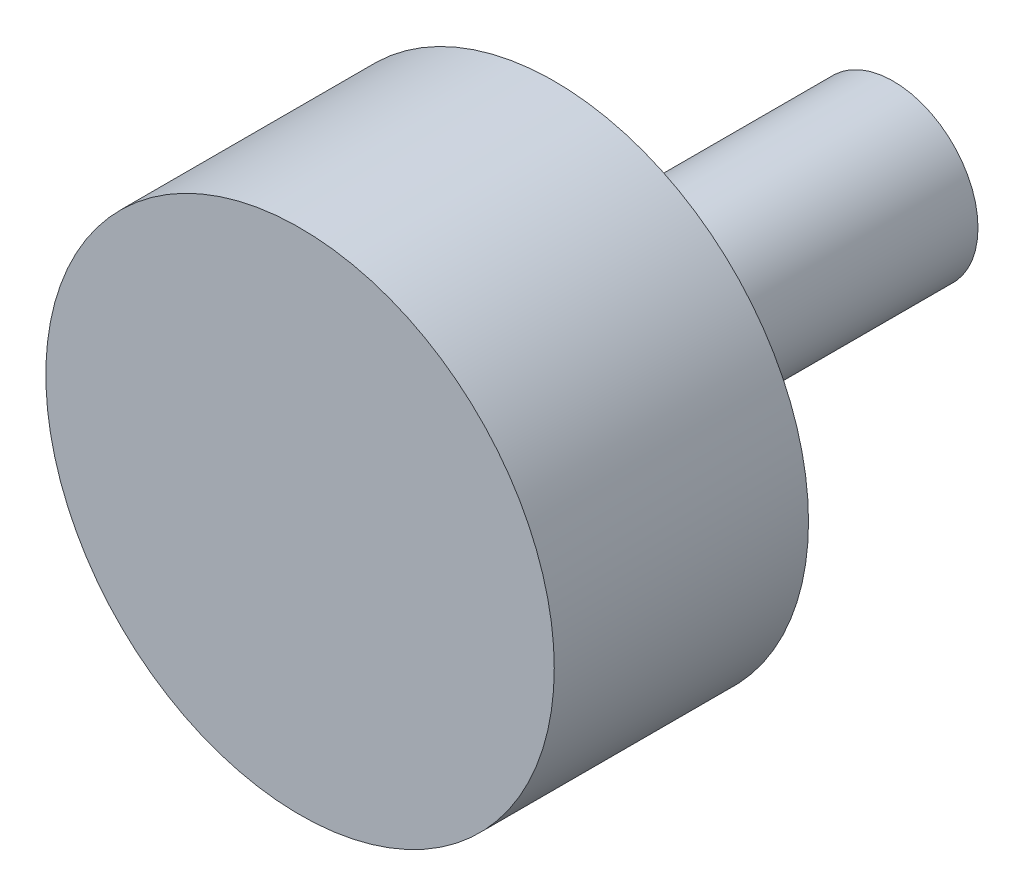
from build123d import *


with BuildPart() as part:
    # Sketch1 → Revolve1 (revolve)
    with BuildSketch(Plane(origin=(0, 0, 0), x_dir=(1, 0, 0), z_dir=(0, 1, 0))):
        with BuildLine():
            Line((127, 508), (0, 508))
            Line((0, 508), (0, -381))
            Line((0, -381), (381, -381))
            Line((381, -381), (381, 0))
            Line((381, 0), (177.8, 0))
            ThreePointArc((177.8, 0), (141.878975516, 14.878975516), (127, 50.8))
            Line((127, 50.8), (127, 508))
        make_face()
    revolve(axis=Axis((0, 0, -508), (0, 0, 1)))


solid = part.part
